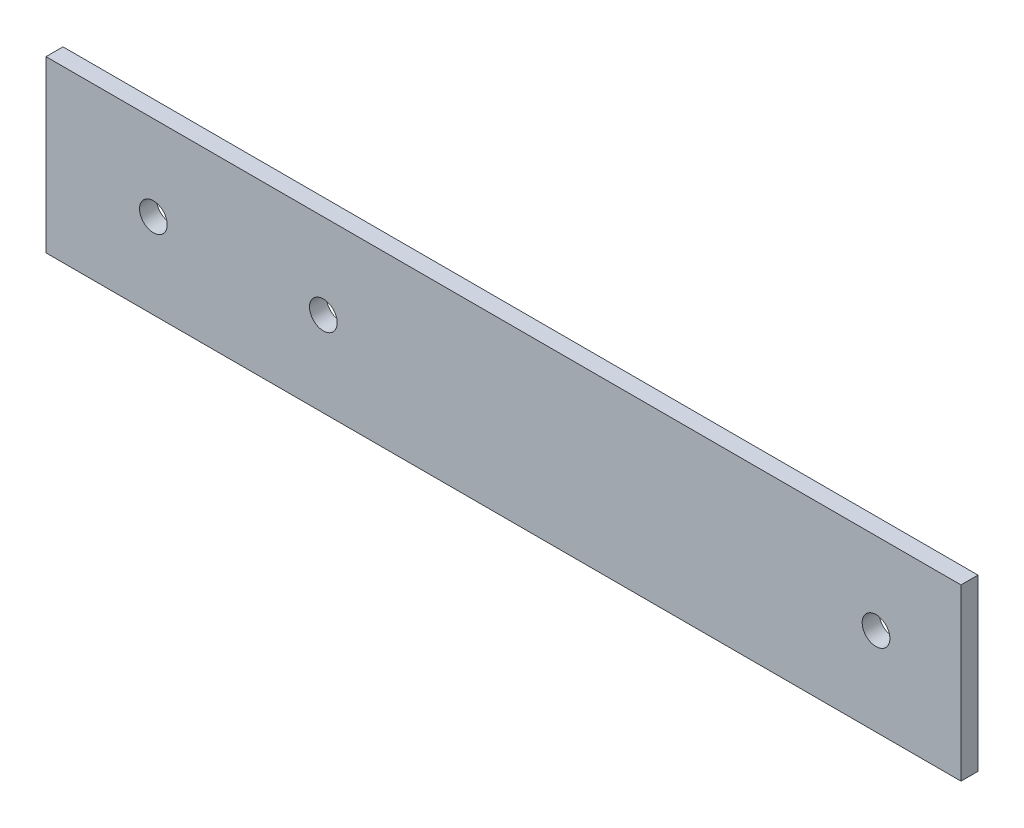
from build123d import *

# Parameters (mm, degrees)
SKETCH1_W           = 136.728026614
SKETCH1_H           = 25.4
SKETCH1_R           = 2.0701
BOSS_EXTRUDE1_DEPTH = 2.54


with BuildPart() as part:
    # Sketch1 → Boss-Extrude1 (new body)
    with BuildSketch(Plane.XY):
        with Locations((-50.574385066, 189.601133889)):
            Rectangle(SKETCH1_W, SKETCH1_H)
        with Locations((5.089627373, 190.04270609)):
            Circle(SKETCH1_R, mode=Mode.SUBTRACT)
        with Locations((-77.492930456, 189.601133897)):
            Circle(SKETCH1_R, mode=Mode.SUBTRACT)
        with Locations((-102.892930456, 189.601133897)):
            Circle(SKETCH1_R, mode=Mode.SUBTRACT)
    extrude(amount=BOSS_EXTRUDE1_DEPTH)


solid = part.part
